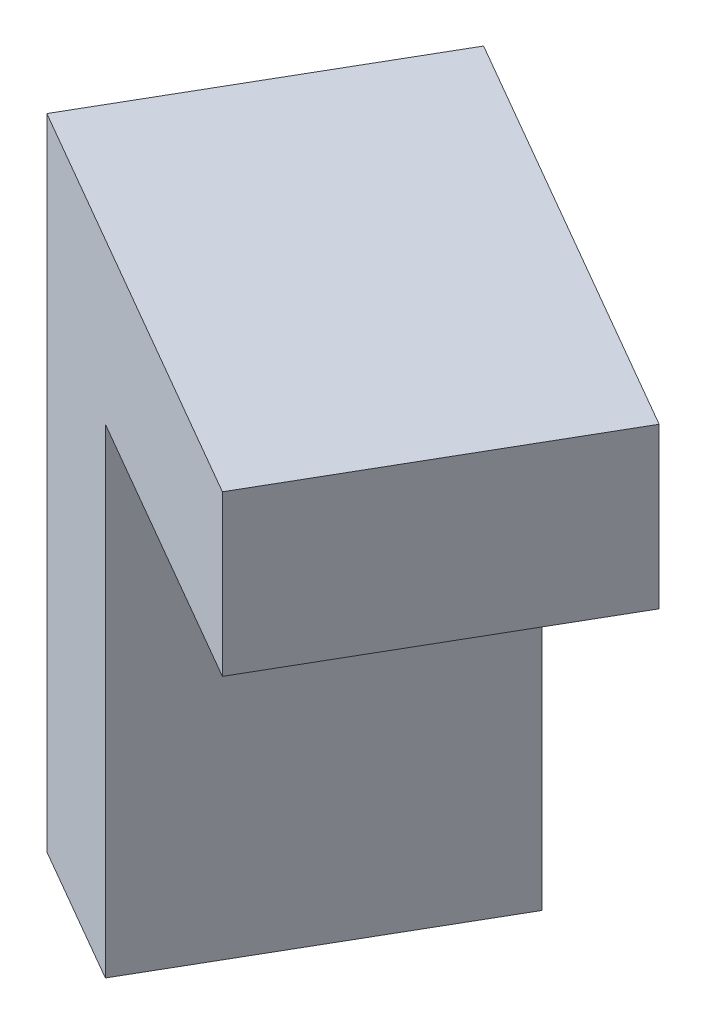
from build123d import *

# Parameters (mm, degrees)
BOSS_EXTRUDE1_DEPTH = 10


with BuildPart() as part:
    # Sketch1 → Boss-Extrude1 (new body)
    with BuildSketch(Plane(origin=(0, 0, 0), x_dir=(0, -1, 0), z_dir=(-0.49999999999999994, 0, 0.8660254037844387))):
        Polygon((5, 5), (25, 5), (25, 10), (10, 10), (10, 20), (5, 20), align=None)
    extrude(amount=BOSS_EXTRUDE1_DEPTH)


solid = part.part
